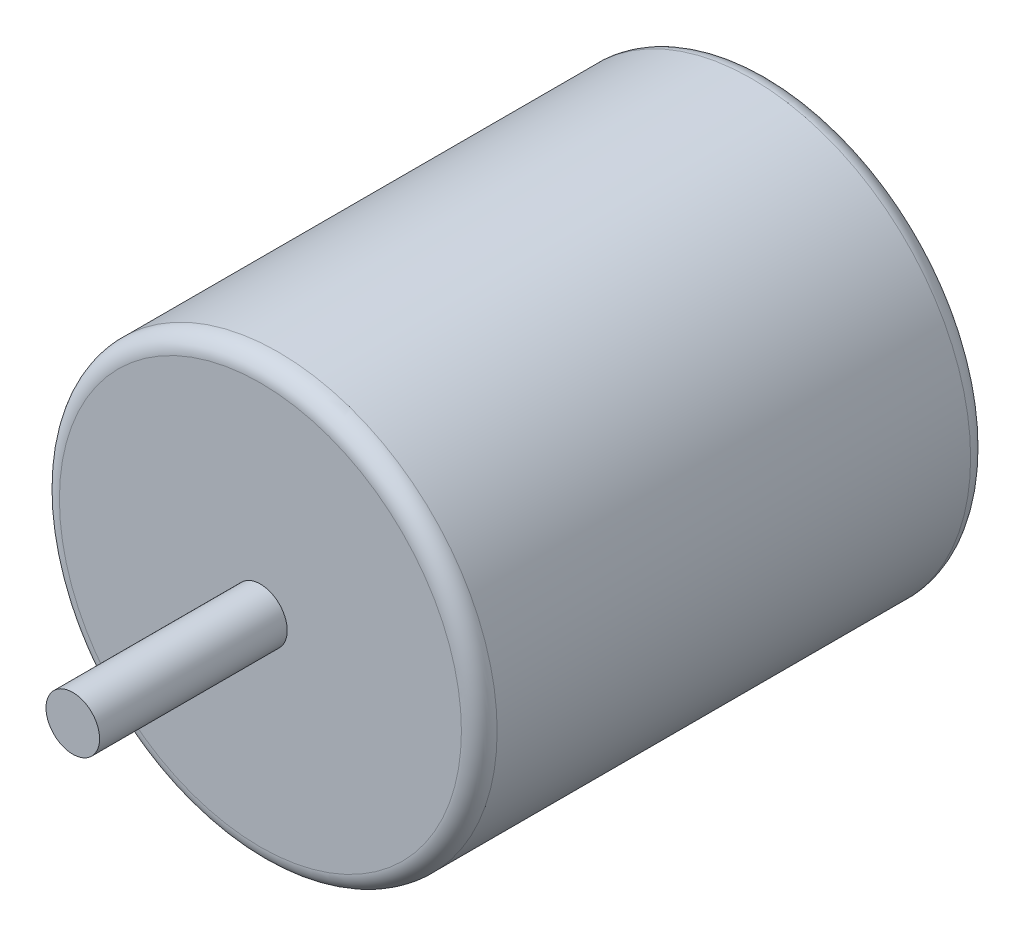
from build123d import *

# Parameters (mm, degrees)
SKETCH1_R           = 24.5
BOSS_EXTRUDE1_DEPTH = 57
SKETCH2_R           = 3
BOSS_EXTRUDE2_DEPTH = 21
FILLET1_R           = 2


with BuildPart() as part:
    # Sketch1 → Boss-Extrude1 (new body)
    with BuildSketch(Plane.XY):
        with Locations(Location((0, 0, 0), (0, 0, 180))):
            Circle(SKETCH1_R)
    extrude(amount=BOSS_EXTRUDE1_DEPTH)

    # Sketch2 → Boss-Extrude2 (add)
    with BuildSketch(Plane.XY.offset(57)):
        with Locations(Location((0, 0, 0), (0, 0, 180))):
            Circle(SKETCH2_R)
    extrude(amount=BOSS_EXTRUDE2_DEPTH)

    # Fillet1
    fillet1_edges = [part.edges().sort_by_distance(p)[0] for p in [
        (24.5, 0, 0),
        (24.5, 0, 57),
    ]]
    fillet(fillet1_edges, radius=FILLET1_R)


solid = part.part
